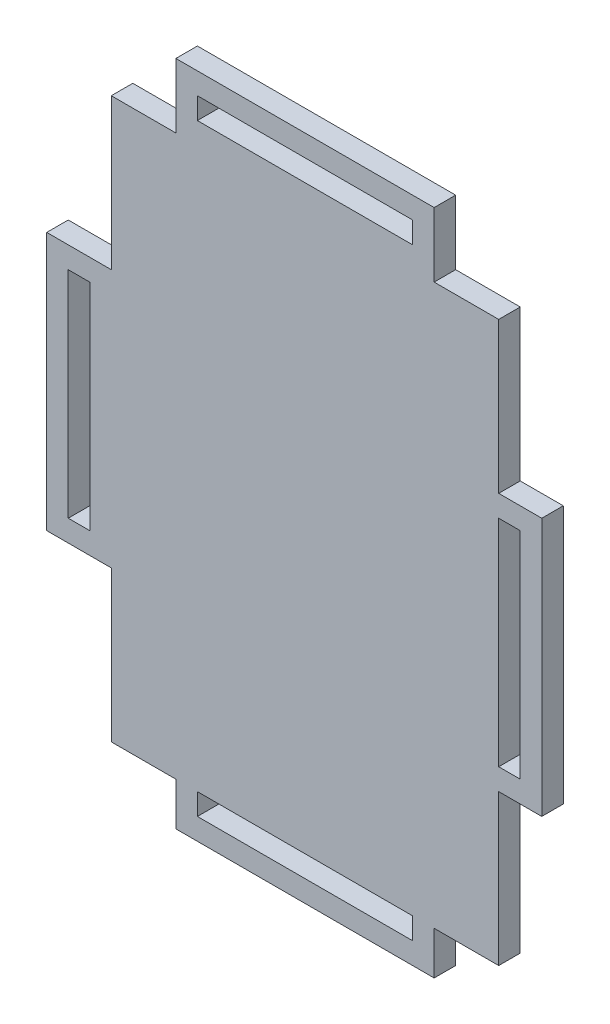
from build123d import *

# Parameters (mm, degrees)
SKETCH1_W           = 90
SKETCH1_H           = 130
BOSS_EXTRUDE1_DEPTH = 5
SKETCH2_W           = 60
SKETCH2_H           = 15
SKETCH2_W_2         = 50
SKETCH2_H_2         = 5
BOSS_EXTRUDE2_DEPTH = 5
SKETCH3_W           = 50
SKETCH3_H           = 5
BOSS_EXTRUDE3_DEPTH = 5
SKETCH4_W           = 15
SKETCH4_H           = 60
SKETCH4_W_2         = 5
SKETCH4_H_2         = 50
BOSS_EXTRUDE4_DEPTH = 5


with BuildPart() as part:
    # Sketch1 → Boss-Extrude1 (new body)
    with BuildSketch(Plane.XY):
        with Locations((-45, -65)):
            Rectangle(SKETCH1_W, SKETCH1_H)
    extrude(amount=BOSS_EXTRUDE1_DEPTH)

    # Sketch2 → Boss-Extrude2 (add)
    # profile 1 of 2: a face of its own
    with BuildSketch(Plane.XY.offset(5)):
        with Locations((-45, 7.5)):
            Rectangle(SKETCH2_W, SKETCH2_H)
        with Locations((-45, 7.5)):
            Rectangle(SKETCH2_W_2, SKETCH2_H_2, mode=Mode.SUBTRACT)
    # profile 2 of 2: a face of its own
    with BuildSketch(Plane.XY.offset(5)):
        Polygon((-15, -140), (-15, -130), (-20, -130), (-20, -135), (-70, -135), (-70, -130), (-75, -130), (-75, -140), align=None)
    extrude(amount=-BOSS_EXTRUDE2_DEPTH)

    # Sketch3 → Boss-Extrude3 (add)
    # profile 1 of 2: a face of its own
    with BuildSketch(Plane.XY.offset(5)):
        Polygon((0, -130), (0, -95), (0, -90), (0, -40), (0, -35), (0, 0), (-15, 0), (-15, 15), (-75, 15), (-75, 0), (-90, 0), (-90, -130), (-75, -130), (-75, -140), (-15, -140), (-15, -130), align=None)
        with Locations((-45, -132.5)):
            Rectangle(SKETCH3_W, SKETCH3_H, mode=Mode.SUBTRACT)
        with Locations((-45, 7.5)):
            Rectangle(SKETCH3_W, SKETCH3_H, mode=Mode.SUBTRACT)
    # profile 2 of 2: a face of its own
    with BuildSketch(Plane.XY.offset(5)):
        Polygon((0, -95), (10, -95), (10, -35), (0, -35), (0, -40), (5, -40), (5, -90), (0, -90), align=None)
    extrude(amount=-BOSS_EXTRUDE3_DEPTH)

    # Sketch4 → Boss-Extrude4 (add)
    with BuildSketch(Plane(origin=(0, 0, 0), x_dir=(-1, 0, 0), z_dir=(0, 0, -1))):
        with Locations((97.5, -65)):
            Rectangle(SKETCH4_W, SKETCH4_H)
        with Locations((97.5, -65)):
            Rectangle(SKETCH4_W_2, SKETCH4_H_2, mode=Mode.SUBTRACT)
    extrude(amount=-BOSS_EXTRUDE4_DEPTH)


solid = part.part
